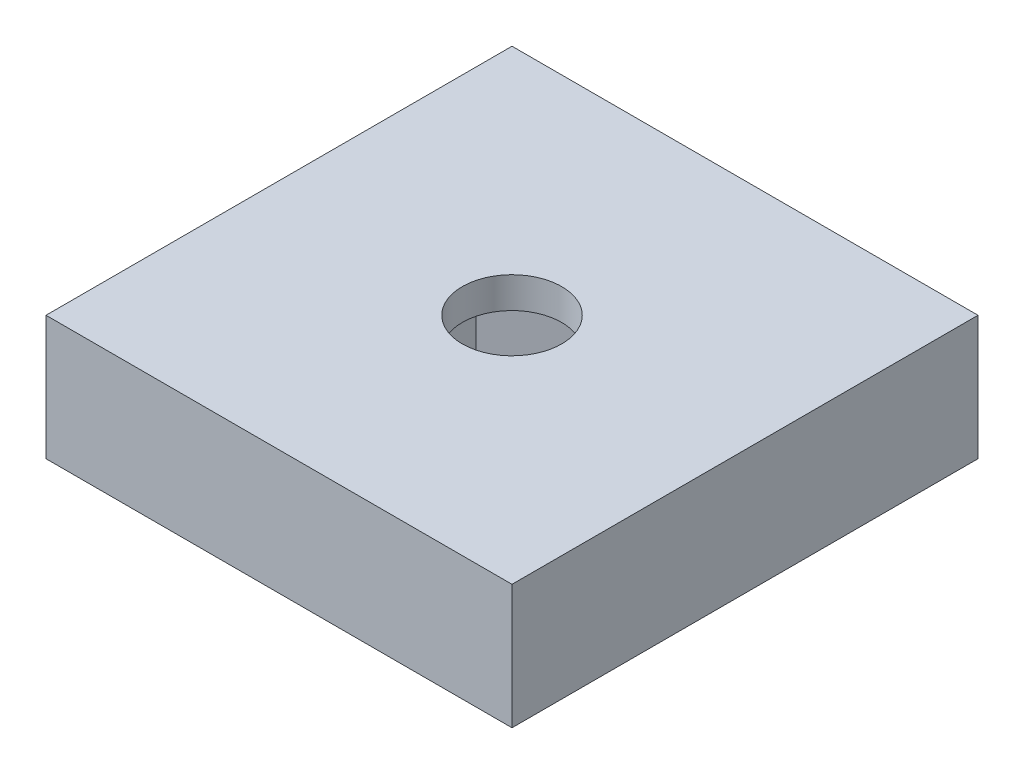
from build123d import *

# Parameters (mm, degrees)
CROQUIS1_W              = 15
CROQUIS1_H              = 15
CROQUIS1_R              = 1.6
SALIENTE_EXTRUIR1_DEPTH = 3
CORTAR_EXTRUIR1_DEPTH   = 2.3
CROQUIS3_W              = 15
CROQUIS3_H              = 15
CROQUIS3_R              = 1.6
SALIENTE_EXTRUIR2_DEPTH = 1


with BuildPart() as part:
    # Croquis1 → Saliente-Extruir1 (new body)
    with BuildSketch(Plane(origin=(0, 0, 0), x_dir=(1, 0, 0), z_dir=(0, 1, 0))):
        with Locations((7.5, 7.5)):
            Rectangle(CROQUIS1_W, CROQUIS1_H)
        with Locations(Location((7.5, 7.5, 0), (0, 0, 270))):
            Circle(CROQUIS1_R, mode=Mode.SUBTRACT)
    extrude(amount=SALIENTE_EXTRUIR1_DEPTH)

    # Croquis2 → Cortar-Extruir1 (cut)
    with BuildSketch(Plane(origin=(0, 3, 0), x_dir=(1, 0, 0), z_dir=(0, 1, 0))):
        Polygon((7.5, 4.324573519), (10.25, 5.91228676), (10.25, 9.08771324), (7.5, 10.675426481), (4.75, 9.08771324), (4.75, 5.91228676), align=None)
    extrude(amount=-CORTAR_EXTRUIR1_DEPTH, mode=Mode.SUBTRACT)

    # Croquis3 → Saliente-Extruir2 (add)
    with BuildSketch(Plane(origin=(0, 3, 0), x_dir=(1, 0, 0), z_dir=(0, 1, 0))):
        with Locations((7.5, 7.5)):
            Rectangle(CROQUIS3_W, CROQUIS3_H)
        with Locations(Location((7.5, 7.5, 0), (0, 0, 270))):
            Circle(CROQUIS3_R, mode=Mode.SUBTRACT)
    extrude(amount=SALIENTE_EXTRUIR2_DEPTH)


solid = part.part
